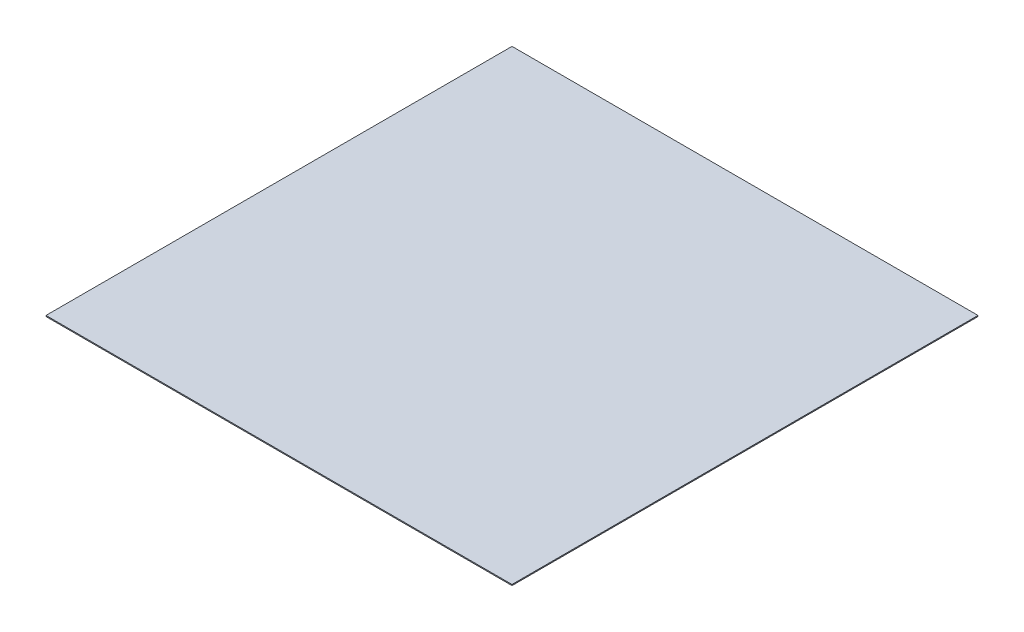
from build123d import *

# Parameters (mm, degrees)
SKETCH1_W           = 114
SKETCH1_H           = 114
BOSS_EXTRUDE1_DEPTH = 0.125


with BuildPart() as part:
    # Sketch1 → Boss-Extrude1 (new, symmetric)
    with BuildSketch(Plane(origin=(0, 0, 0), x_dir=(1, 0, 0), z_dir=(0, 1, 0))):
        Rectangle(SKETCH1_W, SKETCH1_H)
    extrude(amount=BOSS_EXTRUDE1_DEPTH, both=True)


solid = part.part
